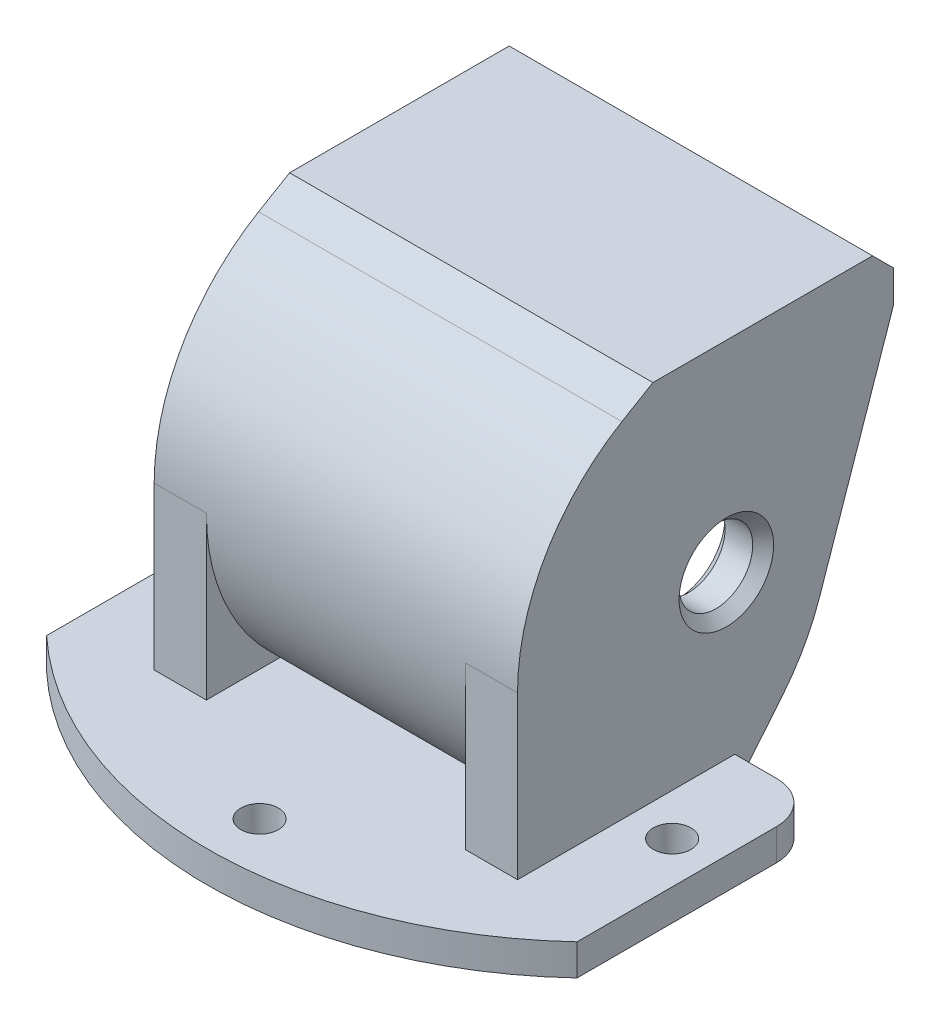
from build123d import *

# Parameters (mm, degrees)
BOSS_EXTRUDE1_DEPTH            = 17.4
CUT_EXTRUDE1_DEPTH             = 12.75
BOSS_EXTRUDE2_DEPTH            = 5
BOSS_EXTRUDE3_REACH            = 51.227
BOSS_EXTRUDE4_DEPTH            = 4.65
BOSS_EXTRUDE5_DEPTH            = 4.65
BOSS_EXTRUDE6_REACH            = 51.227
BOSS_EXTRUDE7_DEPTH            = 4.65
BOSS_EXTRUDE8_START            = -4.65
BOSS_EXTRUDE8_DEPTH            = 4.65
CHAMFER2_SIZE                  = 2
SKETCH10_R                     = 3.525
CUT_EXTRUDE2_DEPTH             = 50.226923528
CUT_EXTRUDE3_DEPTH             = 0.381
BOSS_EXTRUDE9_DEPTH            = 3
BOSS_EXTRUDE10_START           = -5
BOSS_EXTRUDE10_DEPTH           = 5
M3_CLEARANCE_HOLE1_D           = 3.6
M3_CLEARANCE_HOLE2_D           = 3.6
CHAMFER5_SIZE                  = 1
CUT_EXTRUDE4_REACH             = 52.009
CUT_EXTRUDE4_DIRECTION_2_REACH = 52.009
CHAMFER6_SIZE                  = 1


with BuildPart() as part:
    # Sketch1 → Boss-Extrude1 (new, symmetric)
    with BuildSketch(Plane(origin=(0, 0, 0), x_dir=(0, 0, -1), z_dir=(1, 0, 0))):
        with BuildLine():
            Line((0, 17.5), (-10, 17.5))
            ThreePointArc((-10, 17.5), (-20, 0), (-10, -17.5))
            Line((-10, -17.5), (0, -17.5))
            ThreePointArc((0, -17.5), (10, 0), (0, 17.5))
        make_face()
    extrude(amount=BOSS_EXTRUDE1_DEPTH, both=True)

    # Sketch2 → Cut-Extrude1 (cut, symmetric)
    with BuildSketch(Plane(origin=(0, 0, 0), x_dir=(0, 0, -1), z_dir=(1, 0, 0))):
        with BuildLine():
            Line((-6, -17.5), (0, -17.5))
            ThreePointArc((0, -17.5), (10, 0), (0, 17.5))
            Line((0, 17.5), (-6, 17.5))
            ThreePointArc((-6, 17.5), (-16, 0), (-6, -17.5))
        make_face()
    extrude(amount=CUT_EXTRUDE1_DEPTH, both=True, mode=Mode.SUBTRACT)

    # Sketch3 → Boss-Extrude2 (add, symmetric)
    with BuildSketch(Plane(origin=(0, 0, 0), x_dir=(0, 0, -1), z_dir=(1, 0, 0))):
        with BuildLine():
            Line((-9.5, -17.5), (-9.5, -24))
            ThreePointArc((-9.5, -24), (-5, -28.5), (-0.5, -24))
            Line((-0.5, -24), (-0.5, -17.5))
            Line((-0.5, -17.5), (-9.5, -17.5))
        make_face()
    extrude(amount=BOSS_EXTRUDE2_DEPTH, both=True)

    # Boss-Extrude3: up to this face of the body (flat: up to its plane)
    boss_extrude3_end = Plane(part.part.faces().sort_by_distance((-17.4, 0, 5))[0])
    # Sketch4 → Boss-Extrude3 (add, up to the picked face)
    with BuildSketch(Plane(origin=(17.4, 0, 0), x_dir=(0, 0, -1), z_dir=(1, 0, 0)), mode=Mode.PRIVATE) as boss_extrude3_sk1:
        with BuildLine():
            Line((-13.437411512, -9.876147912), (0.981589269, -18.200961894))
            Line((0.981589269, -18.200961894), (0.808939539, -18.5))
            Line((0.808939539, -18.5), (-8.303030303, -18.5))
            Line((-8.303030303, -18.5), (-10, -17.5))
            ThreePointArc((-10, -17.5), (-14.227290753, -14.184221555), (-17.437411512, -9.876147912))
            Line((-17.437411512, -9.876147912), (-13.437411512, -9.876147912))
        make_face()
    boss_extrude3_tool1 = split(extrude(boss_extrude3_sk1.sketch, amount=-BOSS_EXTRUDE3_REACH, mode=Mode.PRIVATE), bisect_by=boss_extrude3_end, keep=Keep.BOTH, mode=Mode.PRIVATE)
    add(boss_extrude3_tool1.solids().sort_by(Axis((17.4, -14.739023, 9.130288), (-1, 0, 0)))[0])

    # Sketch5 → Boss-Extrude4 (add)
    with BuildSketch(Plane(origin=(17.4, 0, 0), x_dir=(0, 0, -1), z_dir=(1, 0, 0))):
        Polygon((5.425994541, -12.841240042), (0.808939539, -18.5), (-1.191060461, -18.5), (-1.191060461, -17.5), align=None)
    extrude(amount=-BOSS_EXTRUDE4_DEPTH)

    # Sketch6 → Boss-Extrude5 (add)
    with BuildSketch(Plane.ZY.offset(17.4)):
        Polygon((-5.425994541, -12.841240042), (-0.808939539, -18.5), (1.191060461, -18.5), (1.191060461, -17.5), align=None)
    extrude(amount=-BOSS_EXTRUDE5_DEPTH)

    # Boss-Extrude6: up to this face of the body (flat: up to its plane)
    boss_extrude6_end = Plane(part.part.faces().sort_by_distance((-17.4, -0.260518526, 4.968984896))[0])
    # Sketch7 → Boss-Extrude6 (add, up to the picked face)
    with BuildSketch(Plane(origin=(17.4, 0, 0), x_dir=(0, 0, -1), z_dir=(1, 0, 0)), mode=Mode.PRIVATE) as boss_extrude6_sk1:
        with BuildLine():
            Line((-10, 17.5), (-7.03030303, 19.25))
            Line((-7.03030303, 19.25), (16, 19.25))
            Line((16, 19.25), (16, 14.121852756))
            Line((16, 14.121852756), (3.105217997, 15.25))
            Line((3.105217997, 15.25), (-13.105217997, 15.25))
            ThreePointArc((-13.105217997, 15.25), (-11.605823563, 16.448441254), (-10, 17.5))
        make_face()
    boss_extrude6_tool1 = split(extrude(boss_extrude6_sk1.sketch, amount=-BOSS_EXTRUDE6_REACH, mode=Mode.PRIVATE), bisect_by=boss_extrude6_end, keep=Keep.BOTH, mode=Mode.PRIVATE)
    add(boss_extrude6_tool1.solids().sort_by(Axis((17.4, 17.022897, -3.374472), (-1, 0, 0)))[0])

    # Sketch8 → Boss-Extrude7 (add)
    with BuildSketch(Plane(origin=(17.4, 0, 0), x_dir=(0, 0, -1), z_dir=(1, 0, 0))):
        with BuildLine():
            Line((16, 14.121852756), (8.902736416, -6.585768423))
            ThreePointArc((8.902736416, -6.585768423), (9.319810717, 5.212488097), (3.105217997, 15.25))
            Line((3.105217997, 15.25), (16, 14.121852756))
        make_face()
    extrude(amount=-BOSS_EXTRUDE7_DEPTH)

    # Sketch9 → Boss-Extrude8 (add)
    with BuildSketch(Plane.ZY.offset(17.4).offset(BOSS_EXTRUDE8_START)):
        with BuildLine():
            Line((-16, 14.121852756), (-8.902736416, -6.585768423))
            ThreePointArc((-8.902736416, -6.585768423), (-9.319810717, 5.212488097), (-3.105217997, 15.25))
            Line((-3.105217997, 15.25), (-16, 14.121852756))
        make_face()
    extrude(amount=BOSS_EXTRUDE8_DEPTH)

    # Chamfer2
    chamfer2_edges = [part.edges().sort_by_distance(p)[0] for p in [
        (0, 19.25, -16),
    ]]
    chamfer(chamfer2_edges, length=CHAMFER2_SIZE)

    # Sketch10 → Cut-Extrude2 (cut, through all)
    with BuildSketch(Plane(origin=(17.4, 0, 0), x_dir=(0, 0, -1), z_dir=(1, 0, 0))):
        Circle(SKETCH10_R)
    extrude(amount=-CUT_EXTRUDE2_DEPTH, mode=Mode.SUBTRACT)

    # Sketch11 → Cut-Extrude3 (cut, symmetric)
    with BuildSketch(Plane(origin=(0, 0, 0), x_dir=(0, 0, -1), z_dir=(1, 0, 0))):
        with BuildLine():
            Line((-9.5, -17.5), (-9.5, -24))
            ThreePointArc((-9.5, -24), (-5, -28.5), (-0.5, -24))
            Line((-0.5, -24), (-0.5, -17.5))
            Line((-0.5, -17.5), (-9.5, -17.5))
        make_face()
    extrude(amount=CUT_EXTRUDE3_DEPTH, both=True, mode=Mode.SUBTRACT)

    # Sketch12 → Boss-Extrude9 (add)
    with BuildSketch(Plane.XZ.offset(18.5)):
        with BuildLine():
            Line((-17.4, -0.808939539), (-21.4, -0.808939539))
            ThreePointArc((-21.4, -0.808939539), (-24.228427125, 0.362633337), (-25.4, 3.191060461))
            Line((-25.4, 3.191060461), (-25.4, 22.303030303))
            ThreePointArc((-25.4, 22.303030303), (0, 32.303030303), (25.4, 22.303030303))
            Line((25.4, 22.303030303), (25.4, 3.191060461))
            ThreePointArc((25.4, 3.191060461), (24.228427125, 0.362633337), (21.4, -0.808939539))
            Line((21.4, -0.808939539), (17.4, -0.808939539))
            Line((17.4, -0.808939539), (17.4, 8.303030303))
            Line((17.4, 8.303030303), (-17.4, 8.303030303))
            Line((-17.4, 8.303030303), (-17.4, -0.808939539))
        make_face()
    extrude(amount=-BOSS_EXTRUDE9_DEPTH)

    # Sketch13 → Boss-Extrude10 (add)
    with BuildSketch(Plane.ZY.offset(17.4).offset(BOSS_EXTRUDE10_START)):
        with BuildLine():
            Line((20, -15.5), (20, 0))
            ThreePointArc((20, 0), (18.116589611, -8.542032098), (12.815624628, -15.5))
            Line((12.815624628, -15.5), (12.815624628, -23.5))
            Line((12.815624628, -23.5), (20, -23.5))
            Line((20, -23.5), (20, -15.5))
        make_face()
    boss_extrude10 = extrude(amount=BOSS_EXTRUDE10_DEPTH)

    # Mirror1: Boss-Extrude10 across plane
    add(boss_extrude10.mirror(Plane(origin=(0, 0, 0), x_dir=(0, 0, 1), z_dir=(1, 0, 0))))

    # M3 Clearance Hole1 (through all)
    with Locations(Plane(origin=(0, -15.5, 0), x_dir=(1, 0, 0), z_dir=(0, 1, 0))):
        with Locations((0, -27.303030303), (-21.4, -9.191060461), (21.4, -9.191060461)):
            Hole(M3_CLEARANCE_HOLE1_D / 2)

    # M3 Clearance Hole2 (through all)
    with Locations(Plane(origin=(5, 0, 0), x_dir=(0, 0, -1), z_dir=(1, 0, 0))):
        with Locations((-5, -24)):
            Hole(M3_CLEARANCE_HOLE2_D / 2)

    # Chamfer5
    chamfer5_edges = [part.edges().sort_by_distance(p)[0] for p in [
        (12.75, 0, 3.525),
        (-12.75, 0, 3.525),
        (-17.4, 0, 3.525),
        (17.4, 0, 3.525),
    ]]
    chamfer(chamfer5_edges, length=CHAMFER5_SIZE)

    # Cut-Extrude4: up to this face of the body (flat: up to its plane)
    cut_extrude4_end = Plane(part.part.faces().sort_by_distance((-12.75, 0, 4.990087357))[0])
    # Sketch18 → Cut-Extrude4 (cut, up to the picked face)
    with BuildSketch(Plane(origin=(0, 0, 0), x_dir=(0, 0, -1), z_dir=(1, 0, 0)), mode=Mode.PRIVATE) as cut_extrude4_sk1:
        with BuildLine():
            Line((-0.5, -18.5), (1.499538462, -18.5))
            Line((1.499538462, -18.5), (-0.232112642, -17.500230769))
            ThreePointArc((-0.232112642, -17.500230769), (0.017518635, -18.102893984), (-0.5, -18.5))
        make_face()
    cut_extrude4_tool1 = split(extrude(cut_extrude4_sk1.sketch, amount=-CUT_EXTRUDE4_REACH, mode=Mode.PRIVATE), bisect_by=cut_extrude4_end, keep=Keep.BOTH, mode=Mode.PRIVATE)
    add(cut_extrude4_tool1.solids().sort_by(Axis((0, -18.22087, -0.457813), (-1, 0, 0)))[0], mode=Mode.SUBTRACT)

    # Cut-Extrude4 direction 2: up to this face of the body (flat: up to its plane)
    cut_extrude4_direction_2_end = Plane(part.part.faces().sort_by_distance((12.75, 0, 4.990087357))[0])
    # Sketch18 → Cut-Extrude4 direction 2 (cut, up to the picked face)
    with BuildSketch(Plane(origin=(0, 0, 0), x_dir=(0, 0, -1), z_dir=(1, 0, 0)), mode=Mode.PRIVATE) as cut_extrude4_direction_2_sk1:
        with BuildLine():
            Line((-0.5, -18.5), (1.499538462, -18.5))
            Line((1.499538462, -18.5), (-0.232112642, -17.500230769))
            ThreePointArc((-0.232112642, -17.500230769), (0.017518635, -18.102893984), (-0.5, -18.5))
        make_face()
    cut_extrude4_direction_2_tool1 = split(extrude(cut_extrude4_direction_2_sk1.sketch, amount=CUT_EXTRUDE4_DIRECTION_2_REACH, mode=Mode.PRIVATE), bisect_by=cut_extrude4_direction_2_end, keep=Keep.BOTH, mode=Mode.PRIVATE)
    add(cut_extrude4_direction_2_tool1.solids().sort_by(Axis((0, -18.22087, -0.457813), (1, 0, 0)))[0], mode=Mode.SUBTRACT)

    # Chamfer6
    chamfer6_edges = [part.edges().sort_by_distance(p)[0] for p in [
        (-17.4, -23.5, 16.407812314),
        (-12.4, -23.5, 16.407812314),
        (-14.9, -23.5, 20),
        (-14.9, -23.5, 12.815624628),
        (14.9, -23.5, 20),
        (12.4, -23.5, 16.407812314),
        (17.4, -23.5, 16.407812314),
        (14.9, -23.5, 12.815624628),
    ]]
    chamfer(chamfer6_edges, length=CHAMFER6_SIZE)


solid = part.part
